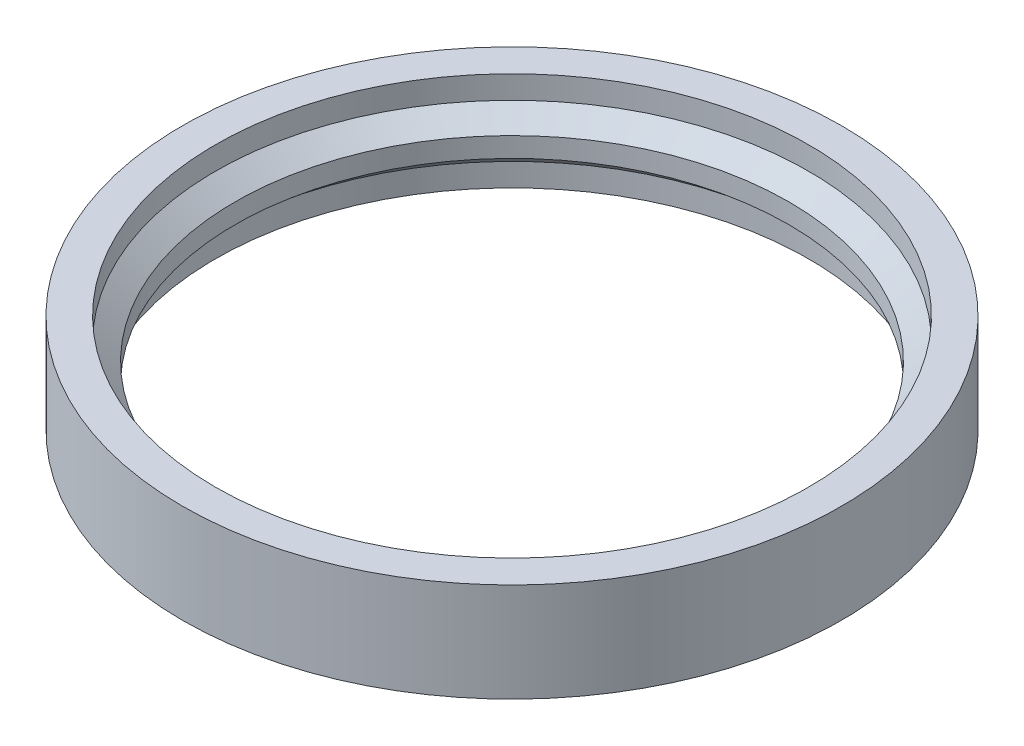
from build123d import *

# Parameters (mm, degrees)
CROQUIS1_R              = 50
CROQUIS1_R_2            = 42
SALIENTE_EXTRUIR1_DEPTH = 15


with BuildPart() as part:
    # Croquis1 → Saliente-Extruir1 (new body)
    with BuildSketch(Plane(origin=(0, 0, 0), x_dir=(1, 0, 0), z_dir=(0, 1, 0))):
        with Locations(Location((0, 0, 0), (0, 0, 270))):
            Circle(CROQUIS1_R)
        with Locations(Location((0, 0, 0), (0, 0, 270))):
            Circle(CROQUIS1_R_2, mode=Mode.SUBTRACT)
    extrude(amount=SALIENTE_EXTRUIR1_DEPTH)

    # Croquis3 → Cortar-Revolución1 (revolve, cut)
    with BuildSketch(Plane.XY, mode=Mode.PRIVATE) as cortar_revoluci_n1_sk:
        Polygon((-45, 11.517298894), (-42, 9), (-42, 15), (-45, 15), align=None)
        Polygon((-45, 0), (-42, 0), (-42, 6), (-45, 3.482701106), align=None)
    revolve(cortar_revoluci_n1_sk.sketch.rotate(Axis((0, 3.82587886, 0), (0, -1, 0)), 270), axis=Axis((0, 3.82587886, 0), (0, -1, 0)), mode=Mode.SUBTRACT)


solid = part.part
